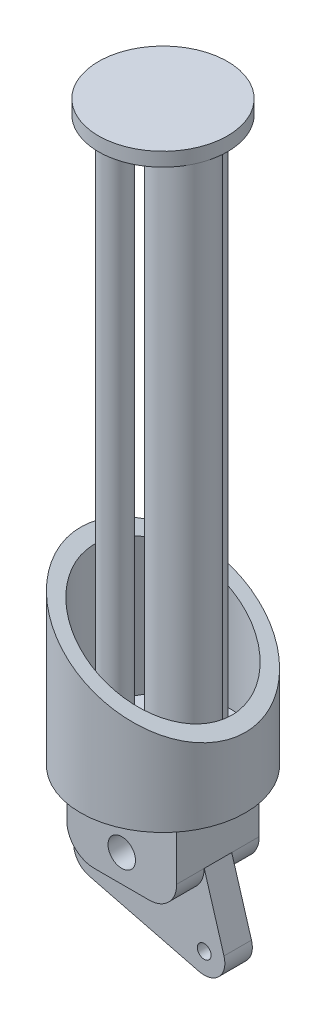
from build123d import *

# Parameters (mm, degrees)
CROQUIS2_R                 = 30
SALIENTE_EXTRUIR1_DEPTH    = 60
CROQUIS3_W                 = 40
CROQUIS3_H                 = 30
SALIENTE_EXTRUIR2_DEPTH    = 30
REDONDEO1_R                = 10
CROQUIS4_R                 = 5
CORTAR_EXTRUIR1_DEPTH      = 81.777472107
CORTAR_EXTRUIR2_DEPTH      = 74.484692283
CORTAR_EXTRUIR2_DEPTH_BACK = 74.484692283
CROQUIS7_R                 = 25
CORTAR_EXTRUIR3_DEPTH      = 70.462219947
CROQUIS8_R                 = 5
CROQUIS8_R_2               = 10
SALIENTE_EXTRUIR3_DEPTH    = 200
CROQUIS10_R                = 23.462912018
SALIENTE_EXTRUIR4_DEPTH    = 5
CROQUIS11_R                = 2.5
SALIENTE_EXTRUIR5_DEPTH    = 5


with BuildPart() as part:
    # Croquis2 → Saliente-Extruir1 (new body)
    with BuildSketch(Plane(origin=(0, 0, 0), x_dir=(1, 0, 0), z_dir=(0, 1, 0))):
        with Locations(Location((0, 0, 0), (0, 0, 270))):
            Circle(CROQUIS2_R)
    extrude(amount=SALIENTE_EXTRUIR1_DEPTH)

    # Croquis3 → Saliente-Extruir2 (add)
    with BuildSketch(Plane.XZ):
        Rectangle(CROQUIS3_W, CROQUIS3_H)
    extrude(amount=SALIENTE_EXTRUIR2_DEPTH)

    # Redondeo1
    redondeo1_edges = [part.edges().sort_by_distance(p)[0] for p in [
        (-20, -30, 0),
        (20, -30, 0),
    ]]
    fillet(redondeo1_edges, radius=REDONDEO1_R)

    # Croquis4 → Cortar-Extruir1 (cut, through all)
    with BuildSketch(Plane.XY.offset(15)):
        with Locations((0, -20)):
            Circle(CROQUIS4_R)
    extrude(amount=-CORTAR_EXTRUIR1_DEPTH, mode=Mode.SUBTRACT)

    # Croquis5 → Cortar-Extruir2 (cut, two sides: drawn at the far end of the back side and taken through both)
    with BuildSketch(Plane.XY.offset(-CORTAR_EXTRUIR2_DEPTH_BACK)):
        Polygon((30, 60), (-30, 60), (30, 25.358983849), align=None)
    extrude(amount=CORTAR_EXTRUIR2_DEPTH + CORTAR_EXTRUIR2_DEPTH_BACK, mode=Mode.SUBTRACT)

    # Croquis7 → Cortar-Extruir3 (cut, through all)
    with BuildSketch(Plane(origin=(0, 5, 0), x_dir=(-1, 0, 0), z_dir=(0, -1, 0))):
        with Locations(Location((0, 0, 0), (0, 0, 90))):
            Circle(CROQUIS7_R)
    extrude(amount=-CORTAR_EXTRUIR3_DEPTH, mode=Mode.SUBTRACT)

    # Croquis8 → Saliente-Extruir3 (add)
    with BuildSketch(Plane(origin=(0, 5, 0), x_dir=(1, 0, 0), z_dir=(0, 1, 0))):
        with Locations(Location((0, 16.650635095, 0), (0, 0, 90))):
            Circle(CROQUIS8_R)
        with Locations(Location((12.5, -5, 0), (0, 0, 90))):
            Circle(CROQUIS8_R_2)
        with Locations(Location((-12.5, -5, 0), (0, 0, 90))):
            Circle(CROQUIS8_R)
    extrude(amount=SALIENTE_EXTRUIR3_DEPTH)

    # Croquis10 → Saliente-Extruir4 (add)
    with BuildSketch(Plane(origin=(0, 205, 0), x_dir=(1, 0, 0), z_dir=(0, 1, 0))):
        with Locations(Location((0, 0, 0), (0, 0, 338.198590514))):
            Circle(CROQUIS10_R)
    extrude(amount=SALIENTE_EXTRUIR4_DEPTH)

    # Croquis11 → Saliente-Extruir5 (add, symmetric)
    with BuildSketch(Plane(origin=(0, 0, 0), x_dir=(-1, 0, 0), z_dir=(0, 0, -1))):
        with BuildLine():
            Line((-27.185083119, -44.006420995), (-20, -20))
            Line((-20, -20), (0.452470226, -27.989728354))
            Line((0.452470226, -27.989728354), (20, -18.654592883))
            Line((20, -18.654592883), (26.768433701, -32.834107425))
            ThreePointArc((26.768433701, -32.834107425), (26.788350186, -39.25372151), (21.834748215, -43.337061956))
            Line((21.834748215, -43.337061956), (-18.165251785, -53.42902271))
            ThreePointArc((-18.165251785, -53.42902271), (-25.417829516, -51.343148457), (-27.185083119, -44.006420995))
        make_face()
        with Locations((-20, -46.156904794)):
            Circle(CROQUIS11_R, mode=Mode.SUBTRACT)
        with Locations((20, -36.06494404)):
            Circle(CROQUIS11_R, mode=Mode.SUBTRACT)
    extrude(amount=SALIENTE_EXTRUIR5_DEPTH, both=True)


solid = part.part
